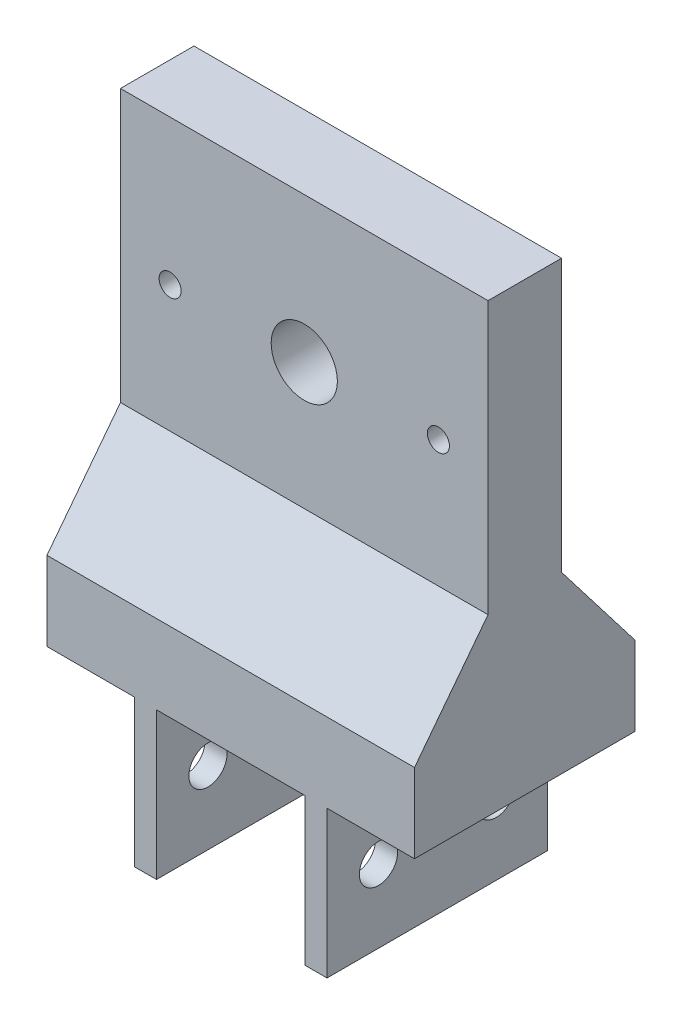
from build123d import *

# Parameters (mm, degrees)
EXTRUDE_1_DEPTH = 30
SKETCH_2_W      = 50
SKETCH_2_H      = 10
EXTRUDE_2_DEPTH = 50
HOLE_WIZARD_2_D = 5.2
HOLE_WIZARD_3_D = 9
SKETCH_17_R     = 2.45
EXTRUDE_6_DEPTH = 4
HOLE_WIZARD_5_D = 3
EXTRUDE_7_DEPTH = 50


with BuildPart() as part:
    # 草图1 → 凸台-拉伸1 (new body)
    with BuildSketch(Plane.XY):
        Polygon((13.1, -5.375), (13.1, -25.375), (10.1, -25.375), (10.1, -5.375), (-10.1, -5.375), (-10.1, -25.375), (-13.1, -25.375), (-13.1, -5.375), (-25, -5.375), (-25, 5.375), (25, 5.375), (25, -5.375), align=None)
    extrude(amount=EXTRUDE_1_DEPTH)

    # 草图2 → 凸台-拉伸2 (add)
    with BuildSketch(Plane(origin=(0, 5.375, 0), x_dir=(1, 0, 0), z_dir=(0, 1, 0))):
        with Locations((0, -15)):
            Rectangle(SKETCH_2_W, SKETCH_2_H)
    extrude(amount=EXTRUDE_2_DEPTH)

    # 孔2 (through all)
    with Locations(Plane.ZY.offset(13.1)):
        with Locations((7, -15.375), (23, -15.375)):
            Hole(HOLE_WIZARD_2_D / 2)

    # 孔3 (through all)
    with Locations(Plane(origin=(0, 0, 10), x_dir=(-1, 0, 0), z_dir=(0, 0, -1))):
        with Locations((0, 35.625)):
            Hole(HOLE_WIZARD_3_D / 2)

    # 草图17 → 凸台-拉伸6 (add)
    with BuildSketch(Plane(origin=(0, 0, 10), x_dir=(-1, 0, 0), z_dir=(0, 0, -1))):
        with Locations(Location((18.25, 35.625, 0), (0, 0, 180))):
            Circle(SKETCH_17_R)
        with Locations(Location((-18.25, 35.625, 0), (0, 0, 180))):
            Circle(SKETCH_17_R)
    extrude(amount=EXTRUDE_6_DEPTH)

    # 孔5 (through all)
    with Locations(Plane(origin=(0, 0, 6), x_dir=(-1, 0, 0), z_dir=(0, 0, -1))):
        with Locations((18.25, 35.625), (-18.25, 35.625)):
            Hole(HOLE_WIZARD_5_D / 2)

    # 草图20 → 凸台-拉伸7 (add)
    with BuildSketch(Plane.ZY.offset(25)):
        Polygon((20, 18.375), (30, 5.375), (20, 5.375), align=None)
        Polygon((10, 18.375), (0, 5.375), (10, 5.375), align=None)
    extrude(amount=-EXTRUDE_7_DEPTH)


solid = part.part
